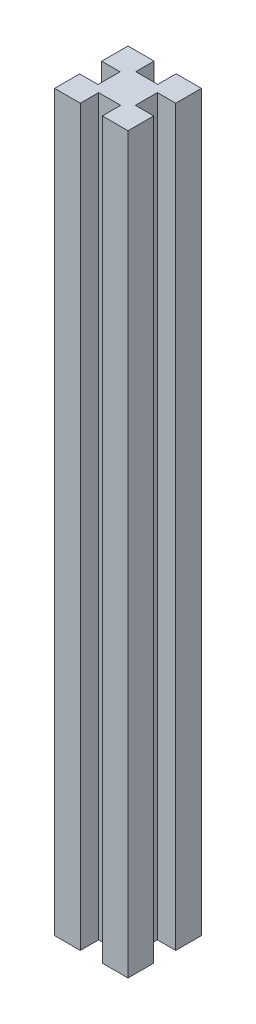
from build123d import *

# Parameters (mm, degrees)
ESQUISSE1_W             = 20
ESQUISSE1_H             = 20
BOSS_EXTRU_1_DEPTH      = 200
ESQUISSE2_W             = 6
ESQUISSE2_H             = 5
ESQUISSE2_W_2           = 5
ESQUISSE2_H_2           = 6
ENL_V_MAT_EXTRU_1_DEPTH = 200


with BuildPart() as part:
    # Esquisse1 → Boss.-Extru.1 (new body)
    with BuildSketch(Plane(origin=(0, 0, 0), x_dir=(1, 0, 0), z_dir=(0, 1, 0))):
        with Locations((10, -10)):
            Rectangle(ESQUISSE1_W, ESQUISSE1_H)
    extrude(amount=BOSS_EXTRU_1_DEPTH)

    # Esquisse2 → Enlèv. mat.-Extru.1 (cut)
    with BuildSketch(Plane(origin=(0, 200, 0), x_dir=(1, 0, 0), z_dir=(0, 1, 0))):
        with Locations((10.112246414, -2.5)):
            Rectangle(ESQUISSE2_W, ESQUISSE2_H)
        with Locations((2.5, -10.178074883)):
            Rectangle(ESQUISSE2_W_2, ESQUISSE2_H_2)
        with Locations((17.5, -10)):
            Rectangle(ESQUISSE2_W_2, ESQUISSE2_H_2)
        with Locations((10, -17.5)):
            Rectangle(ESQUISSE2_W, ESQUISSE2_H)
    extrude(amount=-ENL_V_MAT_EXTRU_1_DEPTH, mode=Mode.SUBTRACT)


solid = part.part
